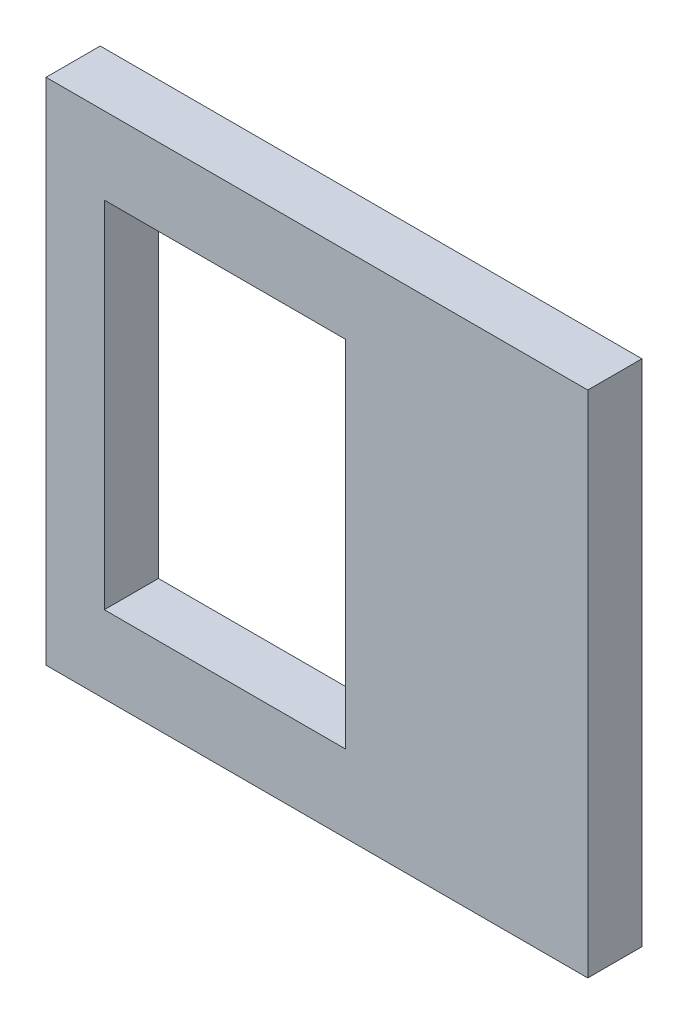
from build123d import *

# Parameters (mm, degrees)
SKETCH1_W           = 100
SKETCH1_H           = 94
BOSS_EXTRUDE1_DEPTH = 10
SKETCH2_W           = 44.5
SKETCH2_H           = 65.5
CUT_EXTRUDE1_DEPTH  = 10


with BuildPart() as part:
    # Sketch1 → Boss-Extrude1 (new body)
    with BuildSketch(Plane.XY):
        Rectangle(SKETCH1_W, SKETCH1_H)
    extrude(amount=BOSS_EXTRUDE1_DEPTH)

    # Sketch2 → Cut-Extrude1 (cut)
    with BuildSketch(Plane.XY.offset(10)):
        with Locations((-17, 0)):
            Rectangle(SKETCH2_W, SKETCH2_H)
    extrude(amount=-CUT_EXTRUDE1_DEPTH, mode=Mode.SUBTRACT)


solid = part.part
